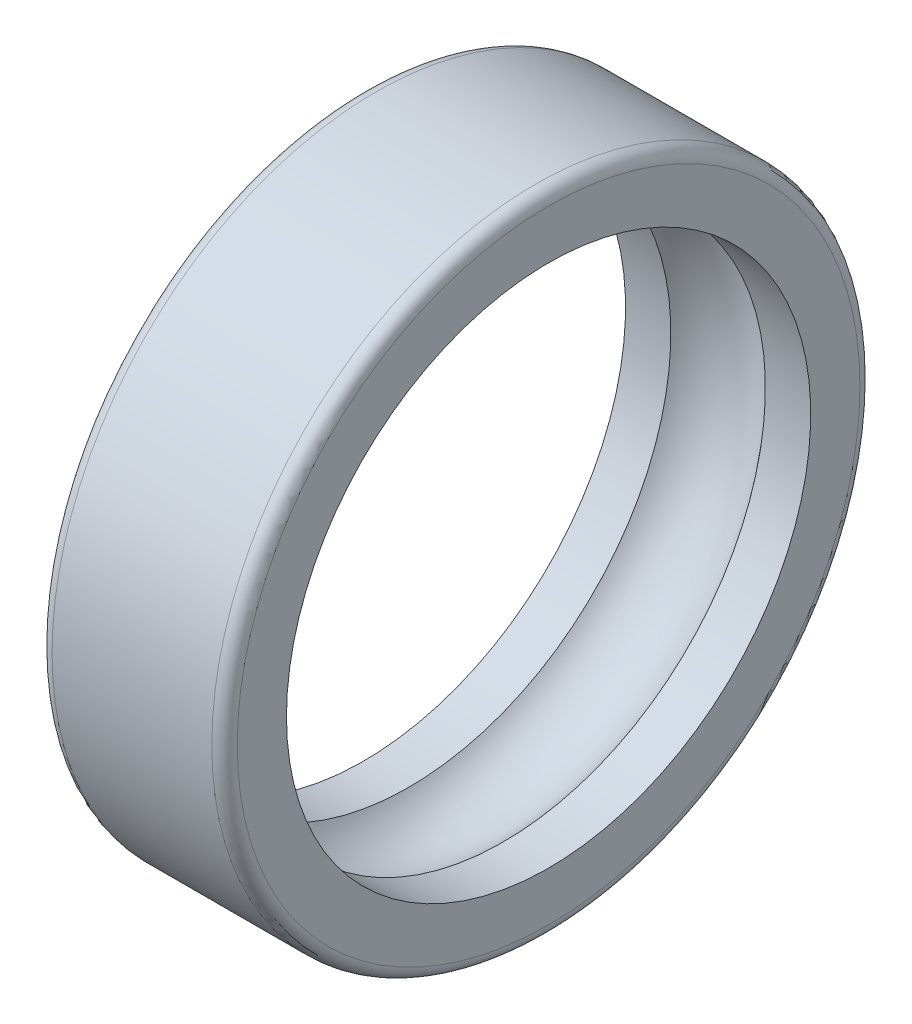
from build123d import *


with BuildPart() as part:
    # Sketch1 → Revolução1 (revolve)
    with BuildSketch(Plane.XY, mode=Mode.PRIVATE) as revolu_o1_sk:
        with BuildLine():
            Line((0, 26.9), (0, 22.65))
            Line((0, 22.65), (3.913688674, 22.65))
            ThreePointArc((3.913688674, 22.65), (8, 24.6595), (12.086311326, 22.65))
            Line((12.086311326, 22.65), (16, 22.65))
            Line((16, 22.65), (16, 26.9))
            ThreePointArc((16, 26.9), (15.677817459, 27.677817459), (14.9, 28))
            Line((14.9, 28), (1.1, 28))
            ThreePointArc((1.1, 28), (0.322182541, 27.677817459), (0, 26.9))
        make_face()
    revolve(revolu_o1_sk.sketch.rotate(Axis((200, 0, 0), (-1, 0, 0)), 270), axis=Axis((200, 0, 0), (-1, 0, 0)))


solid = part.part
